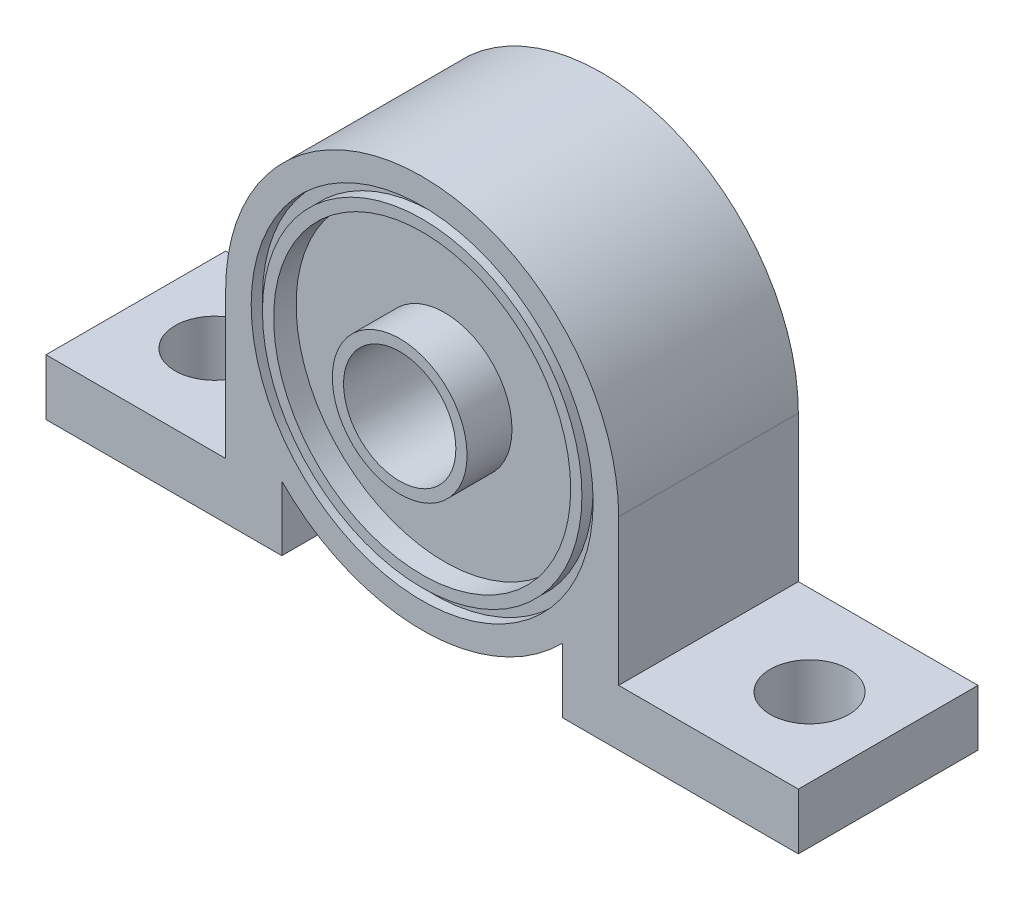
from build123d import *

# Parameters (mm, degrees)
SKETCH_1_R          = 5
EXTRUDE_1_DEPTH     = 16
SKETCH_2_R          = 6
SKETCH_2_R_2        = 5
EXTRUDE_2_DEPTH     = 2
CUT_EXTRUDE_START   = -2
SKETCH_3_R          = 13.227089176
SKETCH_3_R_2        = 6
CUT_EXTRUDE_1_DEPTH = 2
SKETCH_4_R          = 13.402399482
SKETCH_4_R_2        = 6
CUT_EXTRUDE_2_DEPTH = 2
SKETCH_5_R          = 15.227089176
SKETCH_5_R_2        = 14.227089176
CUT_EXTRUDE_3_DEPTH = 1
SKETCH_6_R          = 3.5
CUT_EXTRUDE_4_DEPTH = 10


with BuildPart() as part:
    # 草图1 → 凸台-拉伸1 (new body)
    with BuildSketch(Plane.XY):
        with BuildLine():
            Line((-12.5, -18), (-33.5, -18))
            Line((-33.5, -18), (-33.5, -13))
            Line((-33.5, -13), (-17.5, -13))
            Line((-17.5, -13), (-17.5, 0))
            ThreePointArc((-17.5, 0), (0, 17.5), (17.5, 0))
            Line((17.5, 0), (17.5, -13))
            Line((17.5, -13), (33.5, -13))
            Line((33.5, -13), (33.5, -18))
            Line((33.5, -18), (12.5, -18))
            Line((12.5, -18), (12.5, -12.247448714))
            ThreePointArc((12.5, -12.247448714), (0, -17.5), (-12.5, -12.247448714))
            Line((-12.5, -12.247448714), (-12.5, -18))
        make_face()
        Circle(SKETCH_1_R, mode=Mode.SUBTRACT)
    extrude(amount=EXTRUDE_1_DEPTH)

    # 草图2 → 凸台-拉伸2 (add)
    with BuildSketch(Plane.XY.offset(16)):
        Circle(SKETCH_2_R)
        Circle(SKETCH_2_R_2, mode=Mode.SUBTRACT)
    extrude(amount=EXTRUDE_2_DEPTH)

    # 草图3 → 切除-拉伸1 (cut)
    with BuildSketch(Plane.XY.offset(16).offset(CUT_EXTRUDE_START)):
        Circle(SKETCH_3_R)
        Circle(SKETCH_3_R_2, mode=Mode.SUBTRACT)
    extrude(amount=CUT_EXTRUDE_1_DEPTH, mode=Mode.SUBTRACT)

    # 草图4 → 切除-拉伸2 (cut)
    with BuildSketch(Plane(origin=(0, 0, 0), x_dir=(-1, 0, 0), z_dir=(0, 0, -1))):
        Circle(SKETCH_4_R)
        with Locations(Location((0, 0, 0), (0, 0, 180))):
            Circle(SKETCH_4_R_2, mode=Mode.SUBTRACT)
    extrude(amount=-CUT_EXTRUDE_2_DEPTH, mode=Mode.SUBTRACT)

    # 草图5 → 切除-拉伸3 (cut)
    with BuildSketch(Plane.XY.offset(16)):
        Circle(SKETCH_5_R)
        Circle(SKETCH_5_R_2, mode=Mode.SUBTRACT)
    extrude(amount=-CUT_EXTRUDE_3_DEPTH, mode=Mode.SUBTRACT)

    # 草图6 → 切除-拉伸4 (cut)
    with BuildSketch(Plane.XZ.offset(18)):
        with Locations((26.5, 8)):
            Circle(SKETCH_6_R)
        with Locations(Location((-26.5, 8, 0), (0, 0, 270))):
            Circle(SKETCH_6_R)
    extrude(amount=-CUT_EXTRUDE_4_DEPTH, mode=Mode.SUBTRACT)


solid = part.part
